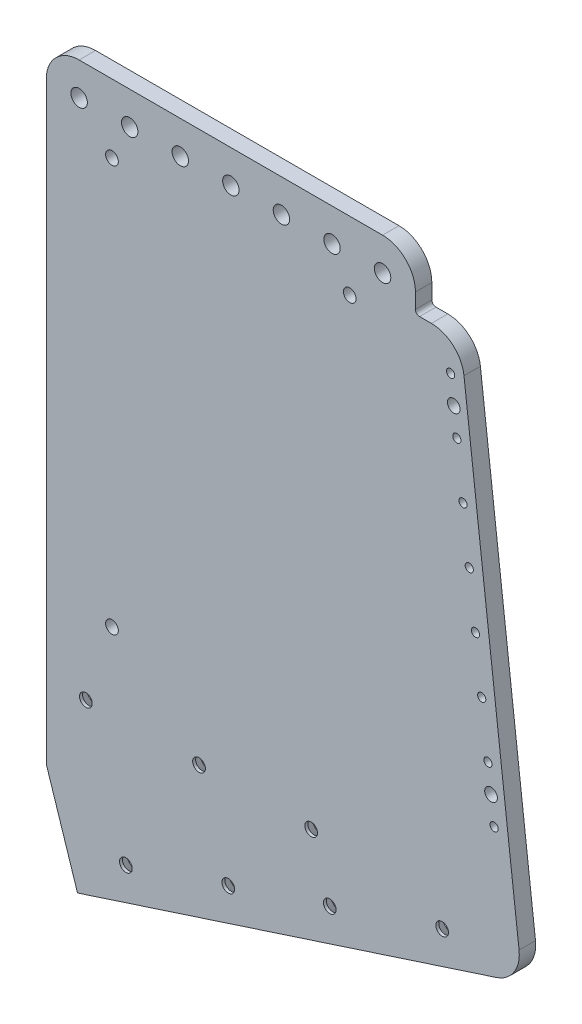
from build123d import *

# Parameters (mm, degrees)
BOSS_EXTRUDE1_DEPTH                           = 6.35
FILLET1_R                                     = 12.7
CUT_EXTRUDE1_DEPTH                            = 359.249441289
CSK_FOR_8_FLAT_HEAD_MACHINE_SCREW1_AT_2_COUNT = 2
CSK_FOR_8_FLAT_HEAD_MACHINE_SCREW1_AT_2_PITCH = 41.643335968
CSK_FOR_8_FLAT_HEAD_MACHINE_SCREW1_AT_3_COUNT = 2
CSK_FOR_8_FLAT_HEAD_MACHINE_SCREW1_AT_3_PITCH = 55.434622241
CSK_FOR_8_FLAT_HEAD_MACHINE_SCREW1_AT_4_COUNT = 2
CSK_FOR_8_FLAT_HEAD_MACHINE_SCREW1_AT_4_PITCH = 50.008853946
CSK_FOR_8_FLAT_HEAD_MACHINE_SCREW1_AT_5_COUNT = 2
CSK_FOR_8_FLAT_HEAD_MACHINE_SCREW1_AT_5_PITCH = 82.918335968
CSK_FOR_8_FLAT_HEAD_MACHINE_SCREW1_AT_6_COUNT = 2
CSK_FOR_8_FLAT_HEAD_MACHINE_SCREW1_AT_6_PITCH = 86.127052655
CSK_FOR_8_FLAT_HEAD_MACHINE_SCREW1_AT_7_COUNT = 2
CSK_FOR_8_FLAT_HEAD_MACHINE_SCREW1_AT_7_PITCH = 128.617381968
F_1_8_0_125_DIAMETER_HOLE1_D                  = 3.175
F_8_CLEARANCE_HOLE1_D                         = 4.9149
F_1_4_0_25_DIAMETER_HOLE1_D                   = 6.35
F_8_CLEARANCE_HOLE2_D                         = 4.9149
F_8_CLEARANCE_HOLE3_D                         = 4.9149
FILLET2_R                                     = 1.5875


with BuildPart() as part:
    # Sketch1 → Boss-Extrude1 (new body)
    with BuildSketch(Plane.XY):
        Polygon((-234.752967181, 12.7), (-91.997327393, 12.7), (-91.997327393, -7.416979032), (-74.533465131, -7.416979032), (-50.700252483, -210.6746006), (-234.752967181, -270.542758328), align=None)
    extrude(amount=BOSS_EXTRUDE1_DEPTH)

    # Fillet1
    fillet1_edges = [part.edges().sort_by_distance(p)[0] for p in [
        (-234.752967181, 12.7, 3.175),
        (-91.997327393, 12.7, 3.175),
        (-74.533465131, -7.416979032, 3.175),
        (-50.700252483, -210.6746006, 3.175),
    ]]
    fillet(fillet1_edges, radius=FILLET1_R)

    # Sketch2 → Cut-Extrude1 (cut, through all)
    with BuildSketch(Plane.XY.offset(6.35)):
        Polygon((-234.752967181, -270.542758328), (-222.67581909, -266.614337017), (-234.752967181, -229.485553098), align=None)
    extrude(amount=-CUT_EXTRUDE1_DEPTH, mode=Mode.SUBTRACT)

    # Sketch4 → CSK for #8 Flat Head Machine Screw1 (revolve, cut)
    with BuildSketch(Plane(origin=(-203.96982343, -247.917009556, 0), x_dir=(0, 1, 0), z_dir=(1, 0, 0))):
        Polygon((0, 0), (0, 6.35), (2.45745, 6.35), (2.45745, 5.19844512), (6.9763894, 0), align=None)
    csk_for_8_flat_head_machine_screw1 = revolve(axis=Axis((-203.96982343, -247.917009556, -6.35), (0, 0, 1)), mode=Mode.SUBTRACT)

    # CSK for #8 Flat Head Machine Screw1 at 2: CSK for #8 Flat Head Machine Screw1 ×2
    with Locations(*[Vector(0.9509565425677294, 0.30932451268470523, 0) * (i * CSK_FOR_8_FLAT_HEAD_MACHINE_SCREW1_AT_2_PITCH) for i in range(1, CSK_FOR_8_FLAT_HEAD_MACHINE_SCREW1_AT_2_COUNT)]):
        add(csk_for_8_flat_head_machine_screw1, mode=Mode.SUBTRACT)

    # CSK for #8 Flat Head Machine Screw1 at 3: CSK for #8 Flat Head Machine Screw1 ×2
    with Locations(*[Vector(0.5102012076622674, 0.8600550724808057, 0) * (i * CSK_FOR_8_FLAT_HEAD_MACHINE_SCREW1_AT_3_PITCH) for i in range(1, CSK_FOR_8_FLAT_HEAD_MACHINE_SCREW1_AT_3_COUNT)]):
        add(csk_for_8_flat_head_machine_screw1, mode=Mode.SUBTRACT)

    # CSK for #8 Flat Head Machine Screw1 at 4: CSK for #8 Flat Head Machine Screw1 ×2
    with Locations(*[Vector(-0.3093245126849687, 0.9509565425676436, 0) * (i * CSK_FOR_8_FLAT_HEAD_MACHINE_SCREW1_AT_4_PITCH) for i in range(1, CSK_FOR_8_FLAT_HEAD_MACHINE_SCREW1_AT_4_COUNT)]):
        add(csk_for_8_flat_head_machine_screw1, mode=Mode.SUBTRACT)

    # CSK for #8 Flat Head Machine Screw1 at 5: CSK for #8 Flat Head Machine Screw1 ×2
    with Locations(*[Vector(0.9509565425676433, 0.30932451268496985, 0) * (i * CSK_FOR_8_FLAT_HEAD_MACHINE_SCREW1_AT_5_PITCH) for i in range(1, CSK_FOR_8_FLAT_HEAD_MACHINE_SCREW1_AT_5_COUNT)]):
        add(csk_for_8_flat_head_machine_screw1, mode=Mode.SUBTRACT)

    # CSK for #8 Flat Head Machine Screw1 at 6: CSK for #8 Flat Head Machine Screw1 ×2
    with Locations(*[Vector(0.8318826599155766, 0.5549515655728751, 0) * (i * CSK_FOR_8_FLAT_HEAD_MACHINE_SCREW1_AT_6_PITCH) for i in range(1, CSK_FOR_8_FLAT_HEAD_MACHINE_SCREW1_AT_6_COUNT)]):
        add(csk_for_8_flat_head_machine_screw1, mode=Mode.SUBTRACT)

    # CSK for #8 Flat Head Machine Screw1 at 7: CSK for #8 Flat Head Machine Screw1 ×2
    with Locations(*[Vector(0.9509565425676432, 0.30932451268497024, 0) * (i * CSK_FOR_8_FLAT_HEAD_MACHINE_SCREW1_AT_7_PITCH) for i in range(1, CSK_FOR_8_FLAT_HEAD_MACHINE_SCREW1_AT_7_COUNT)]):
        add(csk_for_8_flat_head_machine_screw1, mode=Mode.SUBTRACT)

    # 1/8 (0.125) Diameter Hole1 (through all)
    with Locations(Plane.XY.offset(6.35)):
        with Locations((-78.378649341, -20.425753498), (-75.97524073, -40.922827272), (-73.571832119, -61.419901046), (-71.168423508, -81.91697482), (-68.765014897, -102.414048594), (-66.361606286, -122.911122368), (-63.958197675, -143.408196142), (-61.554789065, -163.905269916)):
            Hole(F_1_8_0_125_DIAMETER_HOLE1_D / 2)

    # #8 Clearance Hole1 (through all)
    with Locations(Plane.XY.offset(6.35)):
        with Locations((-77.176945035, -30.674290385), (-62.75649337, -153.656733029)):
            Hole(F_8_CLEARANCE_HOLE1_D / 2)

    # 1/4 (0.25) Diameter Hole1 (through all)
    with Locations(Plane.XY.offset(6.35)):
        with Locations((-104.697327393, 0), (-124.256600695, 0), (-143.815873997, 0), (-163.375147299, 0), (-182.934420601, 0), (-202.493693903, 0), (-222.052967205, 0)):
            Hole(F_1_4_0_25_DIAMETER_HOLE1_D / 2)

    # #8 Clearance Hole2 (through all)
    with Locations(Plane.XY.offset(6.35)):
        with Locations((-117.397327393, -13.766979032), (-209.352967181, -13.766979032)):
            Hole(F_8_CLEARANCE_HOLE2_D / 2)

    # #8 Clearance Hole3 (through all)
    with Locations(Plane.XY.offset(6.35)):
        with Locations((-209.352967181, -170.846075828)):
            Hole(F_8_CLEARANCE_HOLE3_D / 2)

    # Fillet2
    fillet2_edges = [part.edges().sort_by_distance(p)[0] for p in [
        (-91.997327393, -7.416979032, 3.175),
    ]]
    fillet(fillet2_edges, radius=FILLET2_R)


solid = part.part
